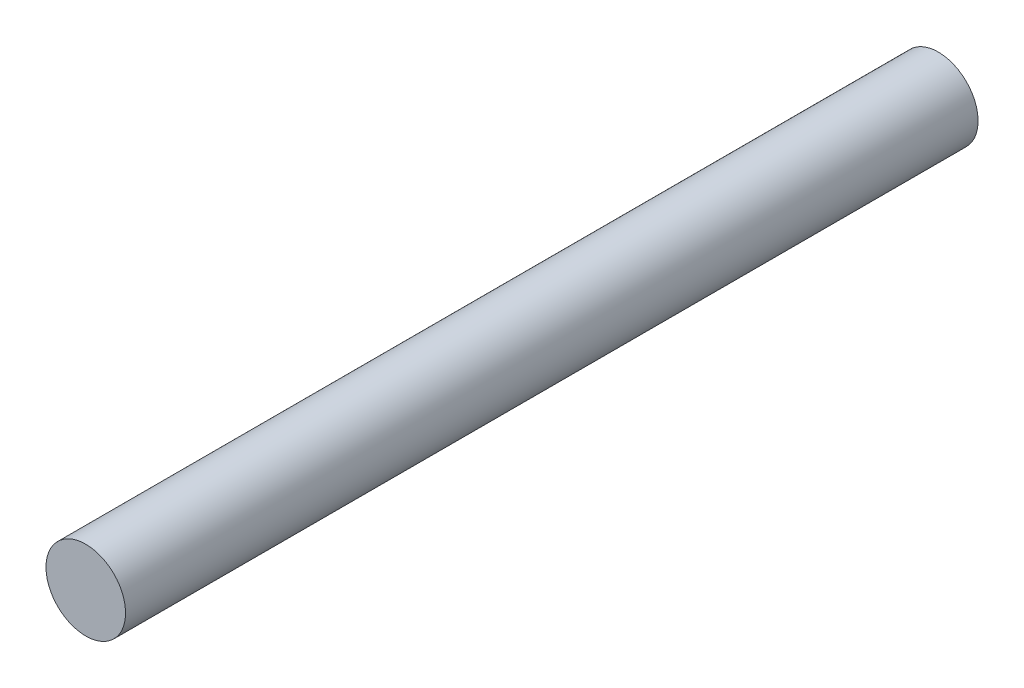
from build123d import *

# Parameters (mm, degrees)
SKETCH1_R           = 1.778
BOSS_EXTRUDE1_DEPTH = 38.1


with BuildPart() as part:
    # Sketch1 → Boss-Extrude1 (new body)
    with BuildSketch(Plane(origin=(0, 0, 0), x_dir=(0, 1, 0), z_dir=(0, 0, 1))):
        with Locations(Location((0, 0, 0), (0, 0, 90))):
            Circle(SKETCH1_R)
    extrude(amount=BOSS_EXTRUDE1_DEPTH)


solid = part.part
